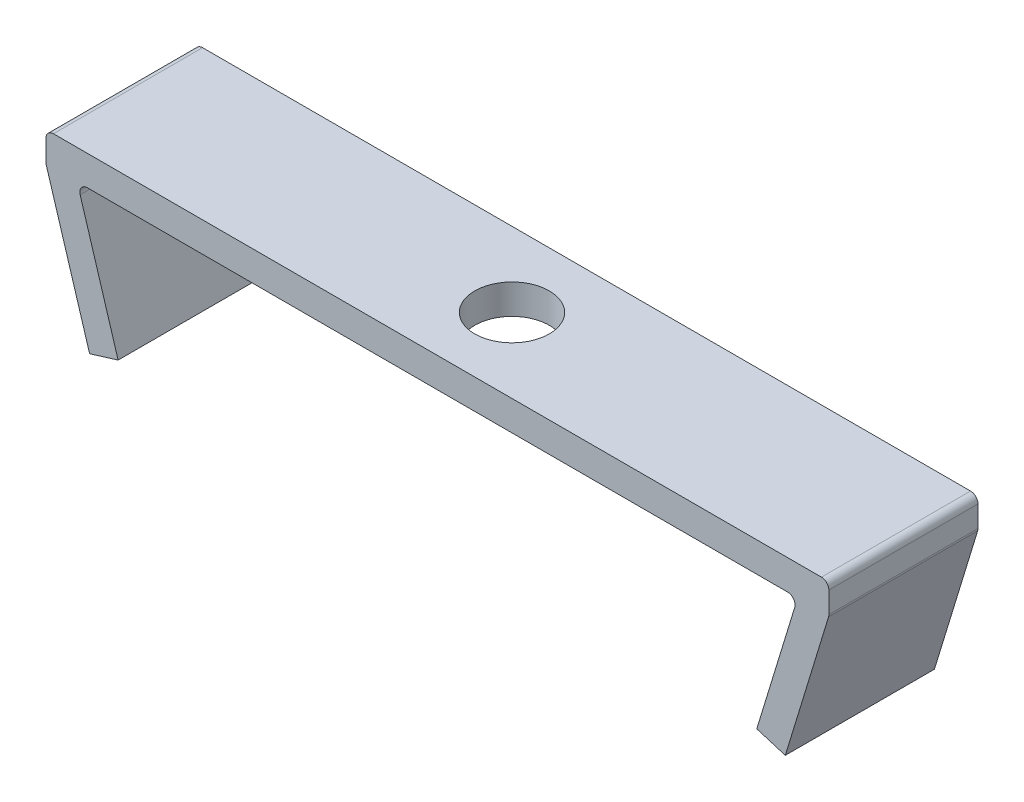
from build123d import *

# Parameters (mm, degrees)
BOSS_EXTRUDE1_DEPTH = 12.7
SKETCH3_R           = 6.35
CUT_EXTRUDE1_DEPTH  = 74.955735381
FILLET1_R           = 1.27


with BuildPart() as part:
    # Sketch2 → Boss-Extrude1 (new, symmetric)
    with BuildSketch(Plane.XY):
        Polygon((66.675, -2.54), (59.2487587, -26.830140801), (54.39073054, -25.344892541), (61.362885877, -2.54), (-61.362885877, -2.54), (-54.39073054, -25.344892541), (-59.2487587, -26.830140801), (-66.675, -2.54), (-66.675, 2.54), (66.675, 2.54), align=None)
    extrude(amount=BOSS_EXTRUDE1_DEPTH, both=True)

    # Sketch3 → Cut-Extrude1 (cut, through all)
    with BuildSketch(Plane(origin=(0, 2.54, 0), x_dir=(1, 0, 0), z_dir=(0, 1, 0))):
        with Locations(Location((0, 0, 0), (0, 0, 270))):
            Circle(SKETCH3_R)
    extrude(amount=-CUT_EXTRUDE1_DEPTH, mode=Mode.SUBTRACT)

    # Fillet1
    fillet1_edges = [part.edges().sort_by_distance(p)[0] for p in [
        (66.675, -2.54, 0),
        (61.362885877, -2.54, 0),
        (-61.362885877, -2.54, 0),
        (-66.675, -2.54, 0),
        (-66.675, 2.54, 0),
        (66.675, 2.54, 0),
    ]]
    fillet(fillet1_edges, radius=FILLET1_R)


solid = part.part
